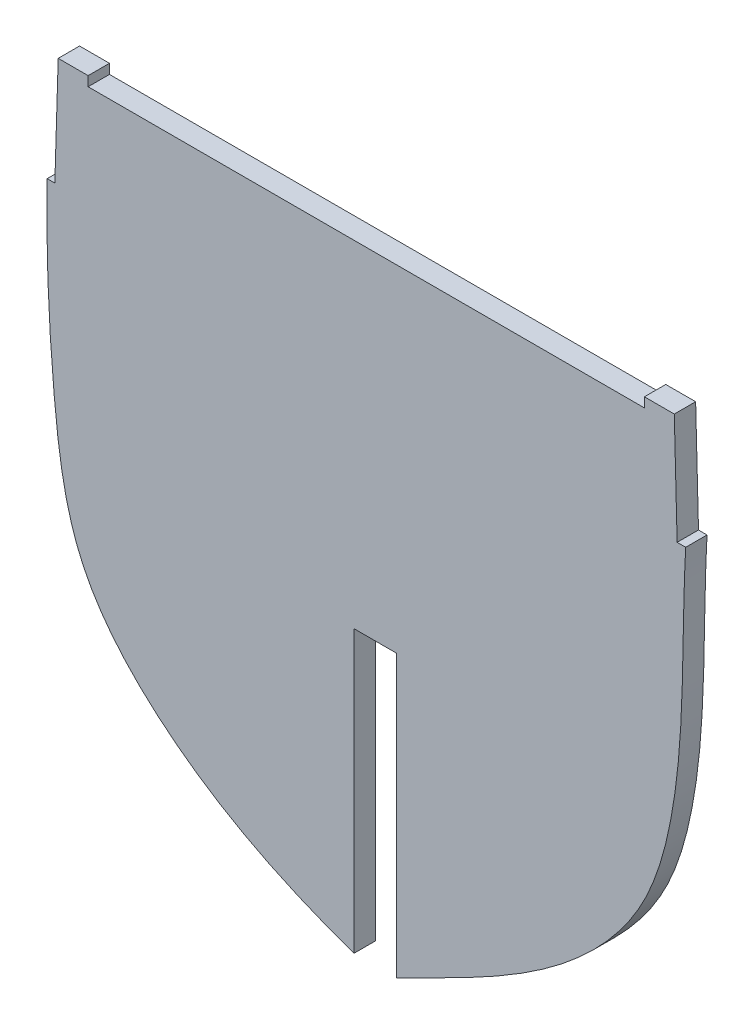
from build123d import *

# Parameters (mm, degrees)
EXTRUDE_1_DEPTH = 4


with BuildPart() as part:
    # 草图1 → 凸台-拉伸1 (new body)
    with BuildSketch(Plane.XY):
        with BuildLine():
            Line((24.544959995, 177.485969069), (128.748328158, 177.485969069))
            Line((128.748328158, 177.485969069), (128.748328158, 179.293294419))
            Line((128.748328158, 179.293294419), (134.346034298, 179.293294419))
            Line((134.346034298, 179.293294419), (134.879857933, 158.745986921))
            Line((134.879857933, 158.745986921), (136.480161375, 158.745986921))
            add(Edge.make_bspline(
                [(82.339222624, 61.799570381), (93.413791621, 67.40108472), (111.733151171, 75.721290264), (128.944446456, 95.047085793), (136.913830684, 122.368393715), (135.612959328, 143.308632698), (136.480161375, 158.745986921)],
                knots=[0, 0, 0, 0, 0.307761121, 0.49025, 0.616329843, 1, 1, 1, 1], degree=3))
            Line((82.339222624, 61.799570381), (82.339222624, 114.477905509))
            Line((82.339222624, 114.477905509), (74.339356348, 114.477905509))
            Line((74.339356348, 114.477905509), (74.339356348, 61.799570381))
            add(Edge.make_bspline(
                [(16.87547225, 158.745986921), (16.656848614, 146.616830277), (17.473837396, 127.05807142), (21.26977179, 98.647925224), (41.890975618, 75.802317121), (61.331956485, 66.364243686), (74.339356348, 61.799570381)],
                knots=[0, 0, 0, 0, 0.287578734, 0.483998215, 0.66783425, 1, 1, 1, 1], degree=3))
            Line((16.87547225, 158.745986921), (18.310507908, 158.745986921))
            Line((18.310507908, 158.745986921), (18.938336008, 179.293294419))
            Line((18.938336008, 179.293294419), (24.544959995, 179.293294419))
            Line((24.544959995, 179.293294419), (24.544959995, 177.485969069))
        make_face()
    extrude(amount=EXTRUDE_1_DEPTH)


solid = part.part
